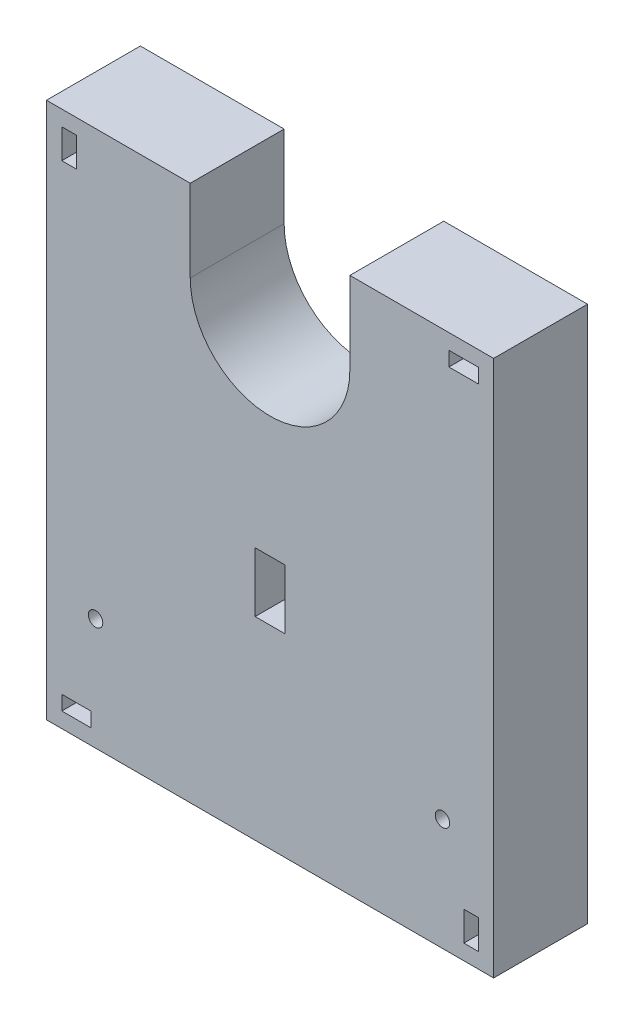
from build123d import *

# Parameters (mm, degrees)
SKETCH1_R           = 1.5367
SKETCH1_R_2         = 1.537816199
SKETCH1_W           = 6.2611
SKETCH1_H           = 3.0861
SKETCH1_W_2         = 6.35
SKETCH1_H_2         = 12.7
SKETCH1_W_3         = 3.0861
SKETCH1_H_3         = 6.2611
BOSS_EXTRUDE5_DEPTH = 20


with BuildPart() as part:
    # Sketch1 → Boss-Extrude5 (new body)
    with BuildSketch(Plane.XY):
        with BuildLine():
            Line((0, 0), (95.25, 0))
            Line((95.25, 0), (95.25, 114.3))
            Line((95.25, 114.3), (64.625, 114.3))
            Line((64.625, 114.3), (64.625, 96.8375))
            ThreePointArc((64.625, 96.8375), (47.625, 79.8375), (30.625, 96.8375))
            Line((30.625, 96.8375), (30.625, 114.3))
            Line((30.625, 114.3), (0, 114.3))
            Line((0, 114.3), (0, 0))
        make_face()
        with Locations((84.348005256, 23.852932932)):
            Circle(SKETCH1_R, mode=Mode.SUBTRACT)
        with Locations((10.458289057, 23.852932932)):
            Circle(SKETCH1_R_2, mode=Mode.SUBTRACT)
        with Locations((6.39445, 4.80695)):
            Rectangle(SKETCH1_W, SKETCH1_H, mode=Mode.SUBTRACT)
        with Locations((47.625, 47.625)):
            Rectangle(SKETCH1_W_2, SKETCH1_H_2, mode=Mode.SUBTRACT)
        with Locations((90.44305, 6.39445)):
            Rectangle(SKETCH1_W_3, SKETCH1_H_3, mode=Mode.SUBTRACT)
        with Locations((4.80695, 107.90555)):
            Rectangle(SKETCH1_W_3, SKETCH1_H_3, mode=Mode.SUBTRACT)
        with Locations((88.85555, 109.49305)):
            Rectangle(SKETCH1_W, SKETCH1_H, mode=Mode.SUBTRACT)
    extrude(amount=BOSS_EXTRUDE5_DEPTH)


solid = part.part
